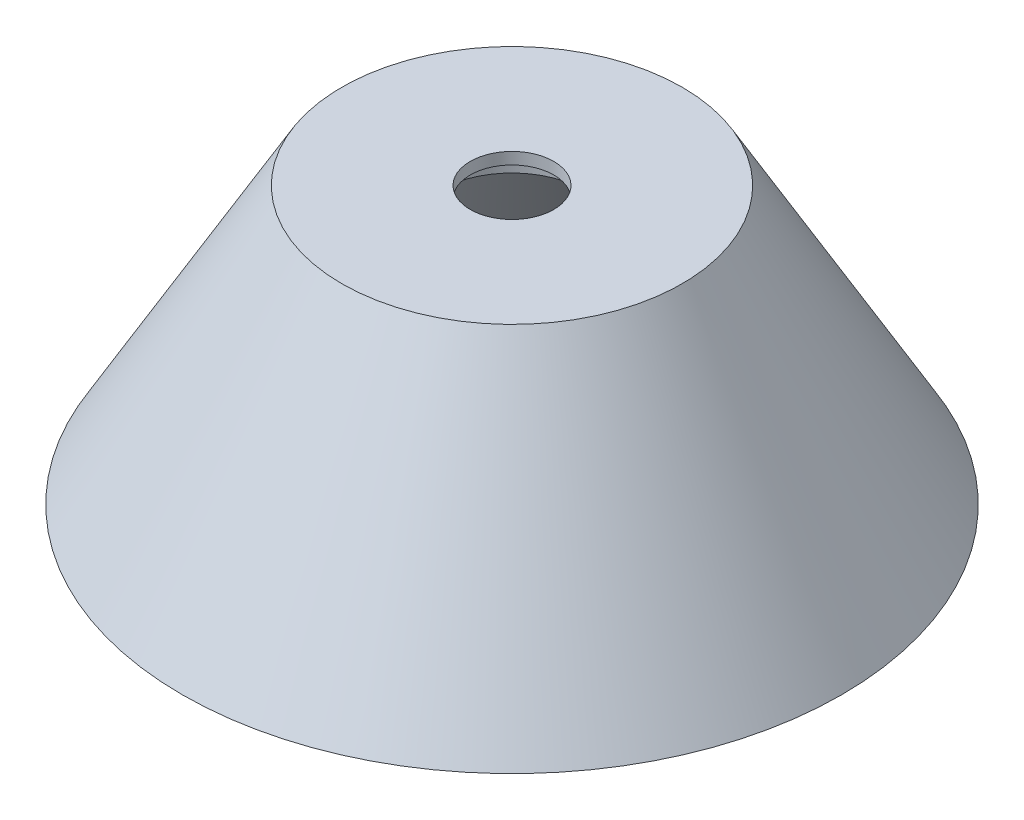
from build123d import *

# Parameters (mm, degrees)
SKETCH_4_R          = 12.5
CUT_EXTRUDE_1_DEPTH = 5
SKETCH_5_R          = 7.1
CUT_EXTRUDE_2_DEPTH = 92.203487258


with BuildPart() as part:
    # 草图2 → 旋转1 (revolve)
    with BuildSketch(Plane.XY, mode=Mode.PRIVATE) as revolve_1_sk:
        Polygon((0, 0), (-30, 0), (-53.094010768, -40), (-56.094010768, -40), (-28.958548116, 7), (0, 7), align=None)
    revolve(revolve_1_sk.sketch.rotate(Axis((0, 0, 0), (0, 1, 0)), 270), axis=Axis((0, 0, 0), (0, 1, 0)))

    # 草图4 → 切除-拉伸1 (cut)
    with BuildSketch(Plane.XZ):
        with Locations(Location((0, 0, 0), (0, 0, 270))):
            Circle(SKETCH_4_R)
    extrude(amount=-CUT_EXTRUDE_1_DEPTH, mode=Mode.SUBTRACT)

    # 草图5 → 切除-拉伸2 (cut, through all)
    with BuildSketch(Plane.XZ.offset(-5)):
        with Locations(Location((0, 0, 0), (0, 0, 270))):
            Circle(SKETCH_5_R)
    extrude(amount=-CUT_EXTRUDE_2_DEPTH, mode=Mode.SUBTRACT)


solid = part.part
